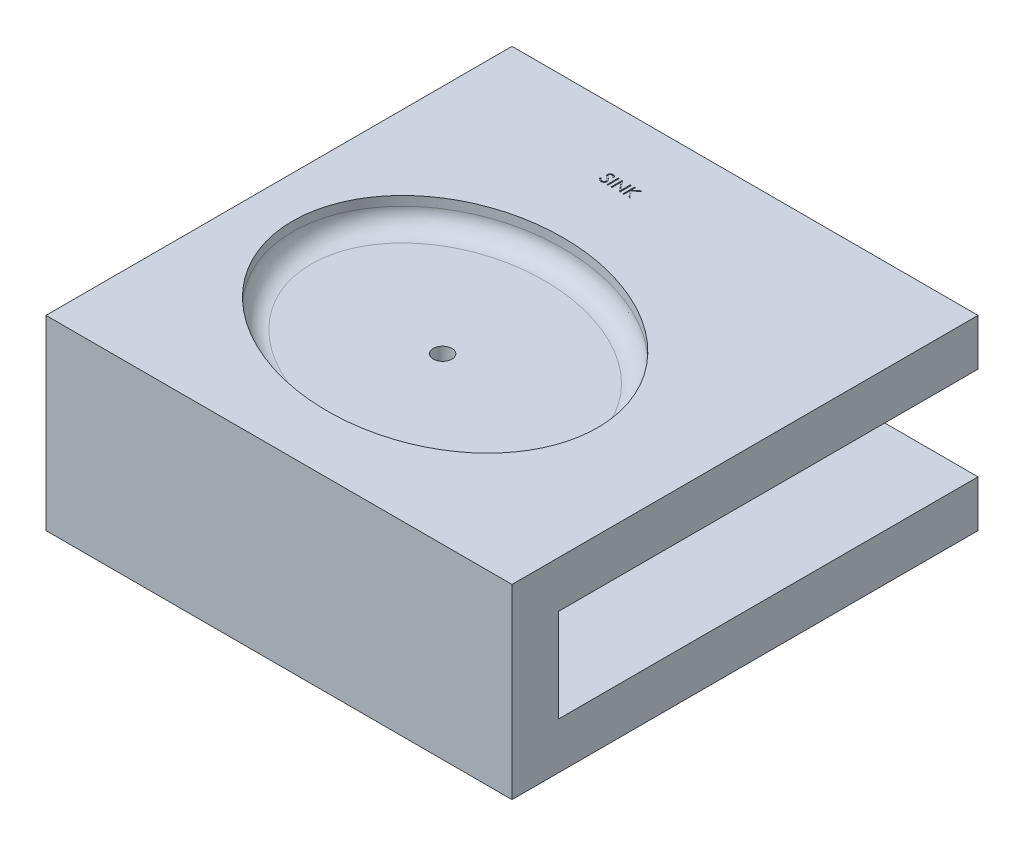
from build123d import *

# Parameters (mm, degrees)
SKETCH1_W           = 127
SKETCH1_H           = 127
BOSS_EXTRUDE1_DEPTH = 50.8
SKETCH2_W           = 114.3
SKETCH2_H           = 25.4
CUT_EXTRUDE1_DEPTH  = 114.3
SKETCH8_RX          = 45.569523195
SKETCH8_RY          = 36.050953419
CUT_EXTRUDE2_DEPTH  = 7.62
FILLET1_R           = 5.08
SKETCH9_W           = 0.284935897
SKETCH9_H           = 3.175
CUT_EXTRUDE3_DEPTH  = 0.254
SKETCH10_R          = 2.54
CUT_EXTRUDE4_DEPTH  = 5.08
RIB1_REACH          = 142.276
SKETCH11_WALL_W     = 23.829756004
SKETCH11_WALL_H     = 2.54


with BuildPart() as part:
    # Sketch1 → Boss-Extrude1 (new body)
    with BuildSketch(Plane(origin=(0, 0, 0), x_dir=(1, 0, 0), z_dir=(0, 1, 0))):
        Rectangle(SKETCH1_W, SKETCH1_H)
    extrude(amount=BOSS_EXTRUDE1_DEPTH)

    # Sketch2 → Cut-Extrude1 (cut)
    with BuildSketch(Plane(origin=(63.5, 0, 0), x_dir=(0, 0, -1), z_dir=(1, 0, 0))):
        with Locations((6.35, 25.4)):
            Rectangle(SKETCH2_W, SKETCH2_H)
    extrude(amount=-CUT_EXTRUDE1_DEPTH, mode=Mode.SUBTRACT)

    # Sketch8 → Cut-Extrude2 (cut)
    with BuildSketch(Plane(origin=(0, 50.8, 0), x_dir=(1, 0, 0), z_dir=(0, 1, 0))):
        with Locations(Location((-7.000681721, -11.218310741), (0, 0, 167.661327575))):
            Ellipse(SKETCH8_RX, SKETCH8_RY)
    extrude(amount=-CUT_EXTRUDE2_DEPTH, mode=Mode.SUBTRACT)

    # Fillet1
    fillet1_edges = [part.edges().sort_by_distance(p)[0] for p in [
        (37.517661419, 43.18, 20.949628351),
    ]]
    fillet(fillet1_edges, radius=FILLET1_R)

    # Sketch9 → Cut-Extrude3 (cut)
    with BuildSketch(Plane(origin=(0, 50.8, 0), x_dir=(1, 0, 0), z_dir=(0, 1, 0))):
        with BuildLine():
            Line((-20.468751556, 44.384329636), (-20.200352117, 44.545242096))
            add(Edge.make_bspline(
                [(-20.200352117, 44.545242096), (-20.175389144, 44.503455118), (-20.127561053, 44.423392881), (-20.047776605, 44.315208802), (-19.965106036, 44.223258845), (-19.878937141, 44.148077923), (-19.789795888, 44.088887861), (-19.697100353, 44.046975837), (-19.601162911, 44.020835631), (-19.535872373, 44.017660552), (-19.503276796, 44.016075429)],
                knots=[0, 0, 0, 0, 1.272034388, 2.437168799, 3.508375237, 4.49857839, 5.41946034, 6.295179144, 7.148887113, 8, 8, 8, 8], degree=3))
            add(Edge.make_bspline(
                [(-19.503276796, 44.016075429), (-19.47543943, 44.016850739), (-19.420251786, 44.018387794), (-19.339006037, 44.033156807), (-19.260101116, 44.055846381), (-19.185163281, 44.088341083), (-19.115226545, 44.127655281), (-19.053897614, 44.175140742), (-19.00087864, 44.228304943), (-18.957508943, 44.287616351), (-18.924234911, 44.35140405), (-18.898660677, 44.416877949), (-18.884468361, 44.485066578), (-18.882330448, 44.530977498), (-18.881251556, 44.554146343)],
                knots=[0, 0, 0, 0, 1.095163259, 2.171163733, 3.241058638, 4.321873601, 5.38011039, 6.391990106, 7.366004449, 8.327778327, 9.272591725, 10.192022065, 11.087607919, 12, 12, 12, 12], degree=3))
            add(Edge.make_bspline(
                [(-18.881251556, 44.554146343), (-18.882588966, 44.580581257), (-18.885307726, 44.634319573), (-18.908286997, 44.713603544), (-18.944435957, 44.792064661), (-18.977784927, 44.840597952), (-18.995098711, 44.865794981)],
                knots=[0, 0, 0, 0, 0.938893495, 1.908633276, 2.914225137, 4, 4, 4, 4], degree=3))
            add(Edge.make_bspline(
                [(-18.995098711, 44.865794981), (-19.009314197, 44.883980314), (-19.039157831, 44.922158145), (-19.090463575, 44.978986323), (-19.150667121, 45.03760446), (-19.217708203, 45.10025089), (-19.294028934, 45.164011963), (-19.377238893, 45.231928187), (-19.469462537, 45.30141676), (-19.534141366, 45.348019016), (-19.567514577, 45.372065013)],
                knots=[0, 0, 0, 0, 0.722233717, 1.516239348, 2.393582979, 3.351407094, 4.387010283, 5.505090956, 6.712668013, 8, 8, 8, 8], degree=3))
            add(Edge.make_bspline(
                [(-19.567514577, 45.372065013), (-19.600919202, 45.395858089), (-19.664786301, 45.441348638), (-19.754102301, 45.508862096), (-19.833971207, 45.570587606), (-19.904038029, 45.627106245), (-19.964271949, 45.67842568), (-20.015147615, 45.724053096), (-20.05536902, 45.765222469), (-20.077735154, 45.791929972), (-20.087776997, 45.803920982)],
                knots=[0, 0, 0, 0, 1.452282411, 2.77665338, 3.964542531, 5.026858415, 5.96415736, 6.766646006, 7.446254459, 8, 8, 8, 8], degree=3))
            add(Edge.make_bspline(
                [(-20.087776997, 45.803920982), (-20.101812805, 45.822609066), (-20.129416107, 45.85936169), (-20.165852412, 45.916806382), (-20.19682151, 45.975610344), (-20.221098768, 46.035931593), (-20.241542338, 46.096923279), (-20.255292747, 46.159381194), (-20.2639028, 46.223025084), (-20.264784531, 46.265854474), (-20.265225915, 46.28729438)],
                knots=[0, 0, 0, 0, 1.068054152, 2.10047183, 3.106115577, 4.101338837, 5.06977816, 6.043150881, 7.020423561, 8, 8, 8, 8], degree=3))
            add(Edge.make_bspline(
                [(-20.265225915, 46.28729438), (-20.264041904, 46.320885675), (-20.261699189, 46.387350276), (-20.24188672, 46.484442529), (-20.210614881, 46.577140208), (-20.166804518, 46.664525582), (-20.110328205, 46.744323293), (-20.044972214, 46.817451242), (-19.967128937, 46.878927027), (-19.881719058, 46.932640823), (-19.788232206, 46.974683198), (-19.690269029, 47.006397802), (-19.587673828, 47.024367628), (-19.518183842, 47.026946422), (-19.482924232, 47.028254917)],
                knots=[0, 0, 0, 0, 1.005424448, 1.989358655, 2.955360095, 3.929531133, 4.905563448, 5.876582895, 6.856512386, 7.866279853, 8.892233794, 9.918561126, 10.94386622, 12, 12, 12, 12], degree=3))
            add(Edge.make_bspline(
                [(-19.482924232, 47.028254917), (-19.445509941, 47.026964459), (-19.371104858, 47.024398151), (-19.261658784, 47.002084676), (-19.15628442, 46.965163352), (-19.071518029, 46.923263641), (-19.005176167, 46.881415857), (-18.954582331, 46.843297874), (-18.903312929, 46.799414739), (-18.850954408, 46.749649566), (-18.798393953, 46.693545728), (-18.74485125, 46.63148746), (-18.690201091, 46.563854013), (-18.65504399, 46.515571787), (-18.637020787, 46.490820021)],
                knots=[0, 0, 0, 0, 1.286793592, 2.559021753, 3.825965368, 5.121522368, 5.803751409, 6.523245864, 7.299691795, 8.125521123, 9.008227632, 9.944561021, 10.946284179, 12, 12, 12, 12], degree=3))
            Line((-18.637020787, 46.490820021), (-18.894607926, 46.295562609))
            add(Edge.make_bspline(
                [(-18.894607926, 46.295562609), (-18.910161736, 46.315600207), (-18.940114738, 46.354187935), (-18.985589344, 46.408227628), (-19.028450617, 46.457591149), (-19.07067848, 46.500467372), (-19.110042703, 46.539204308), (-19.148248877, 46.57236923), (-19.184747181, 46.600287091), (-19.230754665, 46.630080892), (-19.288555738, 46.659614292), (-19.361113138, 46.684605241), (-19.436937831, 46.699623047), (-19.488581139, 46.701608681), (-19.514725114, 46.702613891)],
                knots=[0, 0, 0, 0, 1.181633172, 2.275549214, 3.290209073, 4.226197932, 5.078386478, 5.862611352, 6.581680152, 7.217281963, 8.414376989, 9.595101626, 10.782541182, 12, 12, 12, 12], degree=3))
            add(Edge.make_bspline(
                [(-19.514725114, 46.702613891), (-19.547524245, 46.701514706), (-19.610774279, 46.699395031), (-19.700572565, 46.676244759), (-19.781393482, 46.639794071), (-19.850837595, 46.588708341), (-19.908656138, 46.528182869), (-19.950480376, 46.458533479), (-19.97565374, 46.381623728), (-19.978725579, 46.327973797), (-19.980290017, 46.30065075)],
                knots=[0, 0, 0, 0, 1.14458467, 2.207223713, 3.21896685, 4.227309161, 5.202851033, 6.127160689, 7.046193047, 8, 8, 8, 8], degree=3))
            add(Edge.make_bspline(
                [(-19.980290017, 46.30065075), (-19.979933395, 46.28364048), (-19.979219568, 46.249592125), (-19.969263859, 46.199289764), (-19.956473753, 46.149114478), (-19.936205795, 46.099291849), (-19.908224698, 46.048950537), (-19.871480717, 45.997223675), (-19.825204355, 45.94365534), (-19.789755922, 45.908814365), (-19.771040218, 45.89041938)],
                knots=[0, 0, 0, 0, 0.858281714, 1.717966888, 2.583508476, 3.4729293, 4.427298488, 5.488583878, 6.674047936, 8, 8, 8, 8], degree=3))
            add(Edge.make_bspline(
                [(-19.771040218, 45.89041938), (-19.764090258, 45.884217221), (-19.747578746, 45.86948231), (-19.717392728, 45.845359313), (-19.677530332, 45.815602512), (-19.629032478, 45.778784018), (-19.571004943, 45.736074406), (-19.503441346, 45.688019772), (-19.427094812, 45.633060106), (-19.372918503, 45.594635765), (-19.344272389, 45.574318619)],
                knots=[0, 0, 0, 0, 0.420754252, 0.999615792, 1.744751191, 2.668019286, 3.750313428, 4.999500688, 6.413464383, 8, 8, 8, 8], degree=3))
            add(Edge.make_bspline(
                [(-19.344272389, 45.574318619), (-19.309813739, 45.549243957), (-19.24308934, 45.500690349), (-19.148149964, 45.427741839), (-19.062067723, 45.356397078), (-18.984540389, 45.287111677), (-18.91480205, 45.220411193), (-18.853626404, 45.155493165), (-18.800390108, 45.092822681), (-18.743077531, 45.012474702), (-18.684514366, 44.913794718), (-18.634220999, 44.792892316), (-18.602508784, 44.67151994), (-18.598361766, 44.589943452), (-18.596315658, 44.549694219)],
                knots=[0, 0, 0, 0, 1.163667725, 2.253281268, 3.268753668, 4.215851969, 5.092017293, 5.902905408, 6.650798638, 7.335211899, 8.59617414, 9.77448103, 10.901945474, 12, 12, 12, 12], degree=3))
            add(Edge.make_bspline(
                [(-18.596315658, 44.549694219), (-18.596911777, 44.52122956), (-18.598092437, 44.464853005), (-18.611664123, 44.382071613), (-18.63154839, 44.301670753), (-18.661517881, 44.224644244), (-18.698096746, 44.149582924), (-18.744511843, 44.078455757), (-18.798312385, 44.009688524), (-18.860028729, 43.945114928), (-18.927561798, 43.885836593), (-18.998939149, 43.83310523), (-19.074277611, 43.789137537), (-19.153168484, 43.753259273), (-19.235629889, 43.725198153), (-19.321634093, 43.704866479), (-19.411322864, 43.692388084), (-19.472283301, 43.691092901), (-19.503276796, 43.690434404)],
                knots=[0, 0, 0, 0, 0.983748083, 1.948392443, 2.894712957, 3.844097841, 4.80183111, 5.778335162, 6.776009319, 7.81870978, 8.863265674, 9.881300176, 10.883814829, 11.87499822, 12.874611388, 13.892143829, 14.928324115, 16, 16, 16, 16], degree=3))
            add(Edge.make_bspline(
                [(-19.503276796, 43.690434404), (-19.527257429, 43.690898119), (-19.574916683, 43.691819708), (-19.645410284, 43.699967012), (-19.714479768, 43.711494171), (-19.781258439, 43.729794934), (-19.846606662, 43.751999049), (-19.910240225, 43.779338822), (-19.972189967, 43.812102283), (-20.03280306, 43.84956277), (-20.091925346, 43.89315801), (-20.149002292, 43.943933967), (-20.205906625, 44.000490247), (-20.260958763, 44.064362686), (-20.315272258, 44.134519376), (-20.367776244, 44.211616707), (-20.419557517, 44.295234735), (-20.452047262, 44.354076634), (-20.468751556, 44.384329636)],
                knots=[0, 0, 0, 0, 0.915332311, 1.819136955, 2.706846663, 3.586547465, 4.459518054, 5.340707479, 6.227863349, 7.133153174, 8.059268498, 9.028702269, 10.047606654, 11.120612155, 12.245963614, 13.433783089, 14.680604001, 16, 16, 16, 16], degree=3))
        make_face()
        with Locations((-17.802565659, 45.35934466)):
            Rectangle(SKETCH9_W, SKETCH9_H)
        Polygon((-16.845995146, 43.77184466), (-16.845995146, 46.94684466), (-16.786209489, 46.94684466), (-14.688623351, 44.447931399), (-14.688623351, 46.94684466), (-14.403687453, 46.94684466), (-14.403687453, 43.77184466), (-14.468561251, 43.77184466), (-16.561059248, 46.265033763), (-16.561059248, 43.77184466), align=None)
        Polygon((-13.589584889, 46.94684466), (-13.304648992, 46.94684466), (-13.304648992, 45.737775149), (-11.981096307, 46.94684466), (-11.574681043, 46.94684466), (-13.134832285, 45.522165173), (-11.452565658, 43.77184466), (-11.832268182, 43.77184466), (-13.304648992, 45.304011127), (-13.304648992, 43.77184466), (-13.589584889, 43.77184466), align=None)
    extrude(amount=-CUT_EXTRUDE3_DEPTH, mode=Mode.SUBTRACT)

    # Sketch10 → Cut-Extrude4 (cut)
    with BuildSketch(Plane(origin=(0, 43.18, 0), x_dir=(1, 0, 0), z_dir=(0, 1, 0))):
        with Locations(Location((-8.014563107, -10.891585761, 0), (0, 0, 270))):
            Circle(SKETCH10_R)
    extrude(amount=-CUT_EXTRUDE4_DEPTH, mode=Mode.SUBTRACT)

    # Sketch11 wall → Rib1 (add, up to next)
    with BuildSketch(Plane(origin=(-50.8, 17.492700273, 39.891547227), x_dir=(0, -0.402245014387, -0.915532057549), z_dir=(0, 0.915532057549, -0.402245014387)), mode=Mode.PRIVATE) as rib1_sk1:
        Rectangle(SKETCH11_WALL_W, SKETCH11_WALL_H)
    rib1_tool1 = extrude(rib1_sk1.sketch, amount=-RIB1_REACH, mode=Mode.PRIVATE) - part.part
    add(rib1_tool1.solids().sort_by_distance((-50.8, 17.492700273, 39.891547227))[0])


solid = part.part
